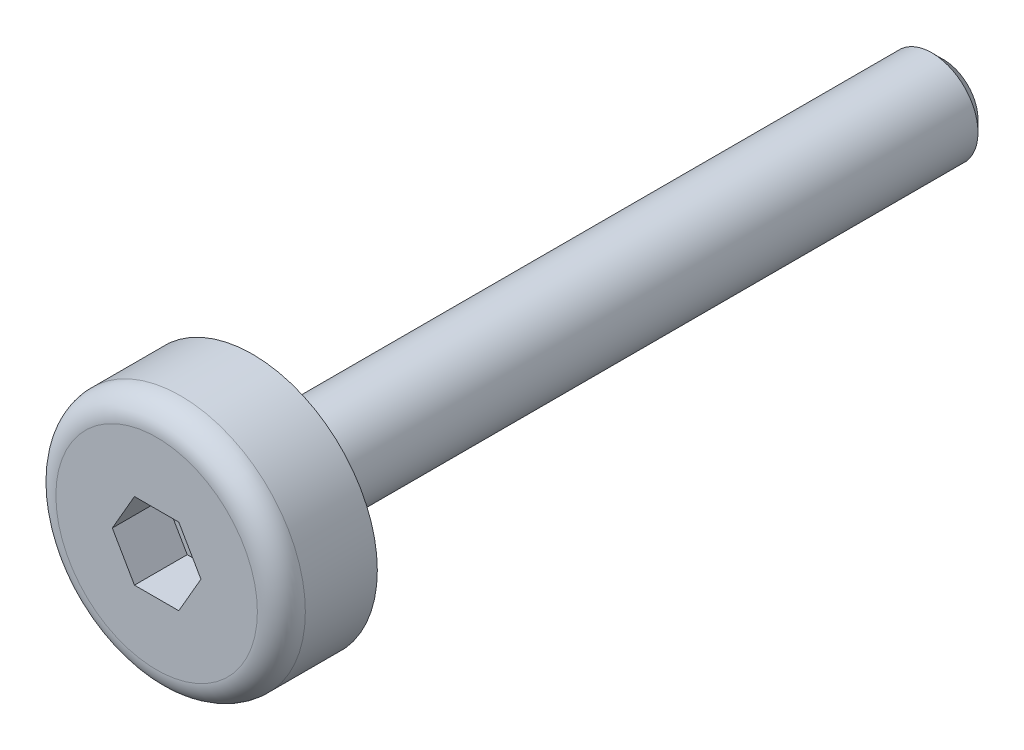
from build123d import *

# Parameters (mm, degrees)
SHANK_TIP_CHAMFER_SIZE = 0.3
PAN_HEAD_ROUND_R       = 0.625
HEX_DRIVE_CUT_DEPTH    = 1.375


with BuildPart() as part:
    # Screw Section → Screw Blank Revolve (revolve)
    with BuildSketch(Plane(origin=(0, 0, 0), x_dir=(1, 0, 0), z_dir=(0, 1, 0))):
        Polygon((0, 18), (1.2, 18), (1.2, 0), (3.25, 0), (3.25, -2.5), (0, -2.5), align=None)
    revolve(axis=Axis((0, 0, 10.123), (0, 0, -1)))

    # Shank Tip Chamfer
    shank_tip_chamfer_edges = [part.edges().sort_by_distance(p)[0] for p in [
        (-1.2, 0, -18),
    ]]
    chamfer(shank_tip_chamfer_edges, length=SHANK_TIP_CHAMFER_SIZE)

    # Pan Head Round
    pan_head_round_edges = [part.edges().sort_by_distance(p)[0] for p in [
        (-3.25, 0, 2.5),
    ]]
    fillet(pan_head_round_edges, radius=PAN_HEAD_ROUND_R)

    # Hex Drive Sketch → Hex Drive Cut (cut)
    with BuildSketch(Plane.XY.offset(2.5)):
        Polygon((1.154700538, 0), (0.577350269, 1), (-0.577350269, 1), (-1.154700538, 0), (-0.577350269, -1), (0.577350269, -1), align=None)
    extrude(amount=-HEX_DRIVE_CUT_DEPTH, mode=Mode.SUBTRACT)


solid = part.part
